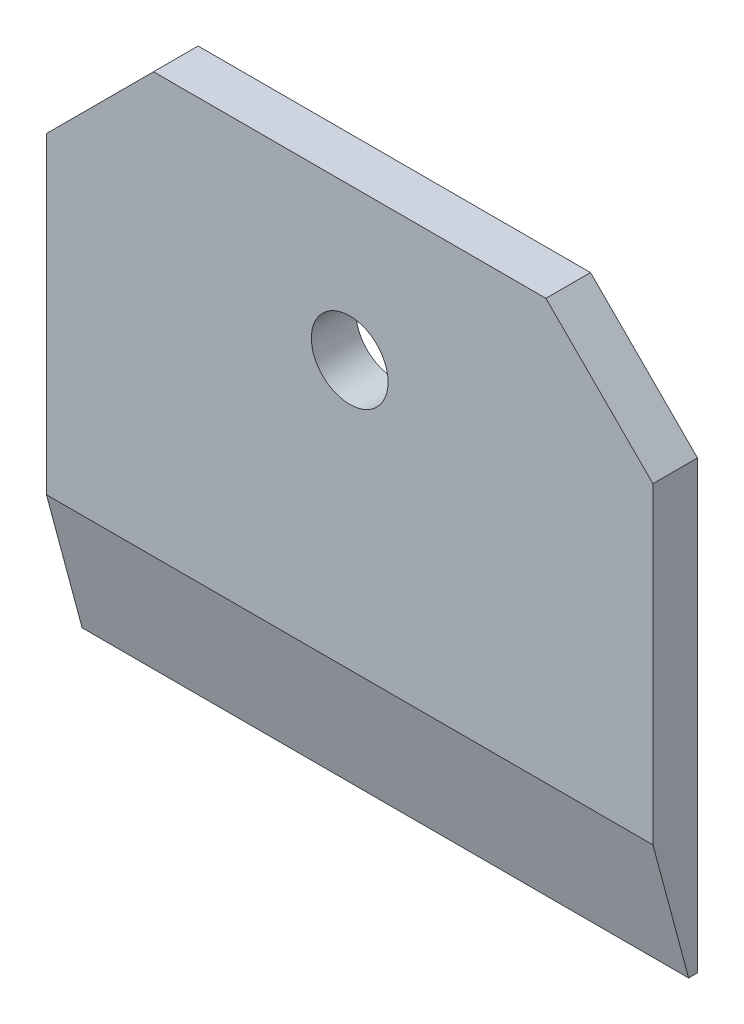
from build123d import *

# Parameters (mm, degrees)
AUFSATZ_LINEAR_AUSTRAGEN1_DEPTH      = 5
F_8_6_8_6_DURCHMESSER_BOHRUNG1_D     = 8.6
F_8_6_8_6_DURCHMESSER_BOHRUNG1_DEPTH = 80
F_8_6_8_6_DURCHMESSER_BOHRUNG1_TIP   = 2.583700662
FASE1_SIZE                           = 4
FASE1_SIZE2                          = 14.92820323


with BuildPart() as part:
    # Skizze1 → Aufsatz-Linear austragen1 (new body)
    with BuildSketch(Plane.XY):
        Polygon((-34, 50), (-22, 62), (22, 62), (34, 50), (34, 0), (-34, 0), align=None)
    extrude(amount=AUFSATZ_LINEAR_AUSTRAGEN1_DEPTH)

    # Ø8.6 (8.6) Durchmesser Bohrung1
    with Locations(Plane.XY.offset(5)):
        with Locations((0, 45)):
            Hole(F_8_6_8_6_DURCHMESSER_BOHRUNG1_D / 2, depth=F_8_6_8_6_DURCHMESSER_BOHRUNG1_DEPTH)
            with Locations((0, 0, -(F_8_6_8_6_DURCHMESSER_BOHRUNG1_DEPTH + F_8_6_8_6_DURCHMESSER_BOHRUNG1_TIP / 2))):  # 118° drill point
                Cone(0, F_8_6_8_6_DURCHMESSER_BOHRUNG1_D / 2, F_8_6_8_6_DURCHMESSER_BOHRUNG1_TIP, mode=Mode.SUBTRACT)

    # Fase1
    fase1_edges = [part.edges().sort_by_distance(p)[0] for p in [
        (0, 0, 5),
    ]]
    fase1_side = [part.faces().sort_by_distance(p)[0] for p in [
        (0, 0, 2.5),
    ]]
    chamfer(fase1_edges, length=FASE1_SIZE, length2=FASE1_SIZE2, reference=fase1_side[0])


solid = part.part
